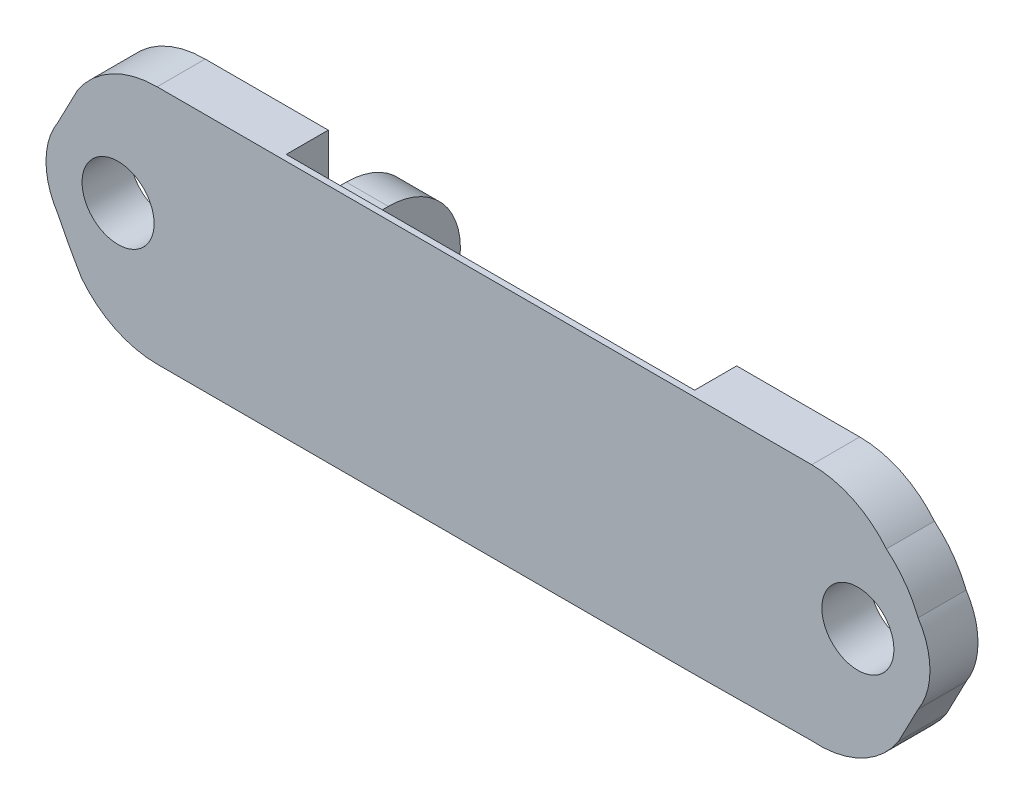
from build123d import *

# Parameters (mm, degrees)
SKETCH1_R           = 3.000027903
BOSS_EXTRUDE1_DEPTH = 4
BOSS_EXTRUDE4_DEPTH = 3.5
BOSS_EXTRUDE6_DEPTH = 34
BOSS_EXTRUDE7_DEPTH = 3.5
BOSS_EXTRUDE8_REACH = 42.713
SKETCH8_R           = 3.000027903


with BuildPart() as part:
    # Sketch1 → Boss-Extrude1 (new body)
    with BuildSketch(Plane.XY):
        with BuildLine():
            ThreePointArc((-35.515, 3.29389), (-36.500003461, -2e-06), (-35.515, -3.293894))
            add(Edge.make_bspline(
                [(-35.515, -3.293894), (-34.604438991, -5.156956918), (-33.54048, -6.937562)],
                knots=[0, 0, 0, 1, 1, 1], degree=2))
            ThreePointArc((-33.54048, -6.937562), (-30.745960827, -9.193764608), (-27.245993386, -10.000000017))
            Line((-27.245993386, -10.000000017), (-16.999993386, -10.000000017))
            Line((-16.999993386, -10.000000017), (-16.999993386, 9.999999983))
            Line((-16.999993386, 9.999999983), (-27.245993386, 9.999999983))
            ThreePointArc((-27.245993386, 9.999999983), (-31.011968955, 9.057189861), (-33.875915, 6.4362595))
            add(Edge.make_bspline(
                [(-33.875915, 6.4362595), (-34.671605619, 4.852572547), (-35.515, 3.29389)],
                knots=[0, 0, 0, 1, 1, 1], degree=2))
        make_face()
        with Locations((-30.500046711, -2e-06)):
            Circle(SKETCH1_R, mode=Mode.SUBTRACT)
    extrude(amount=BOSS_EXTRUDE1_DEPTH)

    # Sketch5 → Boss-Extrude4 (add)
    # profile 1 of 3: a face of its own
    with BuildSketch(Plane(origin=(-16.999993386, 0, 0), x_dir=(0, 0, -1), z_dir=(1, 0, 0))):
        Polygon((0, 2.000001386), (0, 9.999999983), (-3.500601, 9.999999983), (-2, -2.292812017), (-2, -10.000000017), (0, -10.000000017), align=None)
    # profile 2 of 3: a face of its own
    with BuildSketch(Plane(origin=(-16.999993386, 0, 0), x_dir=(0, 0, -1), z_dir=(1, 0, 0))):
        with BuildLine():
            Line((4.999999299, 2.000001386), (0, 2.000001386))
            Line((0, 2.000001386), (0, -10.000000017))
            Line((0, -10.000000017), (4.999999299, -10.000000017))
            ThreePointArc((4.999999299, -10.000000017), (9.242640482, -8.242640499), (11, -3.999999316))
            ThreePointArc((11, -3.999999316), (9.242640482, 0.242641867), (4.999999299, 2.000001386))
        make_face()
        with BuildLine():
            ThreePointArc((5.745163587, -1.412519358), (7.746056235, -2.073529521), (8.6, -3.999999316))
            ThreePointArc((8.6, -3.999999316), (8.009825654, -5.649423344), (6.507230229, -6.550041118))
            ThreePointArc((6.507230229, -6.550041118), (3.428142195, -4.381492167), (5.745163587, -1.412519358))
        make_face(mode=Mode.SUBTRACT)
    # profile 3 of 3: a face of its own
    with BuildSketch(Plane(origin=(-16.999993386, 0, 0), x_dir=(0, 0, -1), z_dir=(1, 0, 0))):
        Polygon((-2, -2.292812017), (-3.500601, 9.999999983), (-4, 9.999999983), (-4, -10.000000017), (-2, -10.000000017), align=None)
    extrude(amount=-BOSS_EXTRUDE4_DEPTH)

    # Sketch5<4> → Boss-Extrude6 (add)
    with BuildSketch(Plane(origin=(-16.999993386, 0, 0), x_dir=(0, 0, -1), z_dir=(1, 0, 0))):
        Polygon((-2, -2.292812017), (-3.500601, 9.999999983), (-4, 9.999999983), (-4, -10.000000017), (-2, -10.000000017), align=None)
    extrude(amount=BOSS_EXTRUDE6_DEPTH)


with BuildPart() as body_2:
    # Sketch7 → Boss-Extrude7 (new body)
    with BuildSketch(Plane(origin=(17.000006614, 0, 0), x_dir=(0, 0, -1), z_dir=(1, 0, 0))):
        with BuildLine():
            Line((4.999999299, 1.98580143), (0, 1.98580143))
            Line((0, 1.98580143), (0, -10.014199973))
            Line((0, -10.014199973), (4.999999299, -10.014199973))
            ThreePointArc((4.999999299, -10.014199973), (9.242640482, -8.256840455), (11, -4.014199272))
            ThreePointArc((11, -4.014199272), (9.242640482, 0.228441911), (4.999999299, 1.98580143))
        make_face()
        with BuildLine():
            ThreePointArc((5.745163587, -1.426719314), (7.746056235, -2.087729477), (8.6, -4.014199272))
            ThreePointArc((8.6, -4.014199272), (8.009825654, -5.6636233), (6.507230229, -6.564241074))
            ThreePointArc((6.507230229, -6.564241074), (3.428142195, -4.395692123), (5.745163587, -1.426719314))
        make_face(mode=Mode.SUBTRACT)
    extrude(amount=BOSS_EXTRUDE7_DEPTH)

    # Boss-Extrude8: up to this face of the body (flat: up to its plane)
    boss_extrude8_end = Plane(body_2.part.faces().sort_by_distance((18.750006614, -4.014199272, 0))[0])
    # Sketch8 → Boss-Extrude8 (add, up to the picked face)
    with BuildSketch(Plane.XY.offset(4), mode=Mode.PRIVATE) as boss_extrude8_sk1:
        with BuildLine():
            Line((17.000006614, -10.000000017), (27.246006614, -9.904922539))
            ThreePointArc((27.246006614, -9.904922539), (31.344343382, -9.110808917), (34.467826641, -6.341182039))
            add(Edge.make_bspline(
                [(34.467826641, -6.341182039), (35.26351726, -4.757495086), (36.106911641, -3.198812539)],
                knots=[0, 0, 0, 1, 1, 1], degree=2))
            ThreePointArc((36.106911641, -3.198812539), (37.091915102, 0.095079461), (36.106911641, 3.388971461))
            add(Edge.make_bspline(
                [(36.106911641, 3.388971461), (35.255873472, 5.530984122), (33.464737791, 7.032639461)],
                knots=[0, 0, 0, 1, 1, 1], degree=2))
            ThreePointArc((33.464737791, 7.032639461), (30.691215095, 9.22014949), (27.246006614, 9.999999983))
            Line((27.246006614, 9.999999983), (17.000006614, 9.999999983))
            Line((17.000006614, 9.999999983), (17.000006614, -8.622062624))
            Line((17.000006614, -8.622062624), (17.000006614, -10.000000017))
        make_face()
        with Locations((31.091958352, 0.095079461)):
            Circle(SKETCH8_R, mode=Mode.SUBTRACT)
    boss_extrude8_tool1 = split(extrude(boss_extrude8_sk1.sketch, amount=-BOSS_EXTRUDE8_REACH, mode=Mode.PRIVATE), bisect_by=boss_extrude8_end, keep=Keep.BOTH, mode=Mode.PRIVATE)

    add(part.part)  # Boss-Extrude8 merges part
    add(boss_extrude8_tool1.solids().sort_by(Axis((25.518798, -0.0257, 4), (0, 0, -1)))[0])


solid = body_2.part
